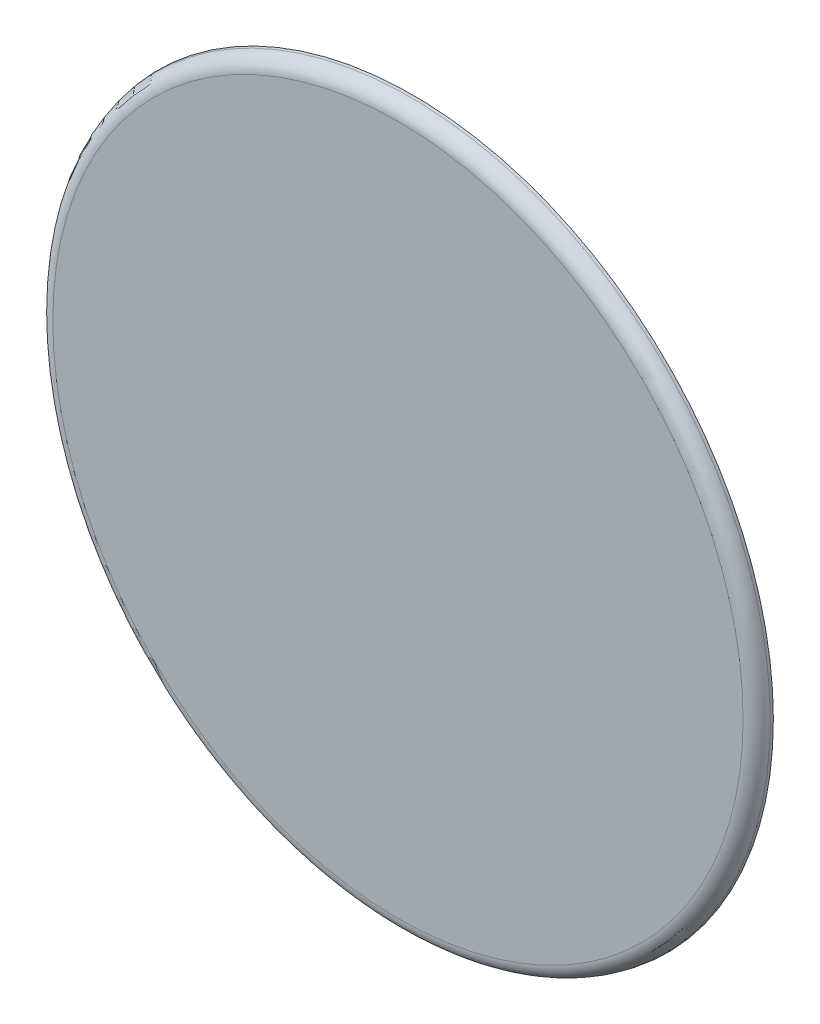
from build123d import *

# Parameters (mm, degrees)
SKETCH1_R           = 240
BOSS_EXTRUDE1_DEPTH = 10
BOSS_EXTRUDE1_TAPER = 10
FILLET1_R           = 10


with BuildPart() as part:
    # Sketch1 → Boss-Extrude1 (new body)
    with BuildSketch(Plane.XY):
        Circle(SKETCH1_R)
    extrude(amount=BOSS_EXTRUDE1_DEPTH, taper=BOSS_EXTRUDE1_TAPER)

    # Fillet1
    fillet1_edges = [part.edges().sort_by_distance(p)[0] for p in [
        (-238.236730193, 0, 10),
    ]]
    fillet(fillet1_edges, radius=FILLET1_R)


solid = part.part
